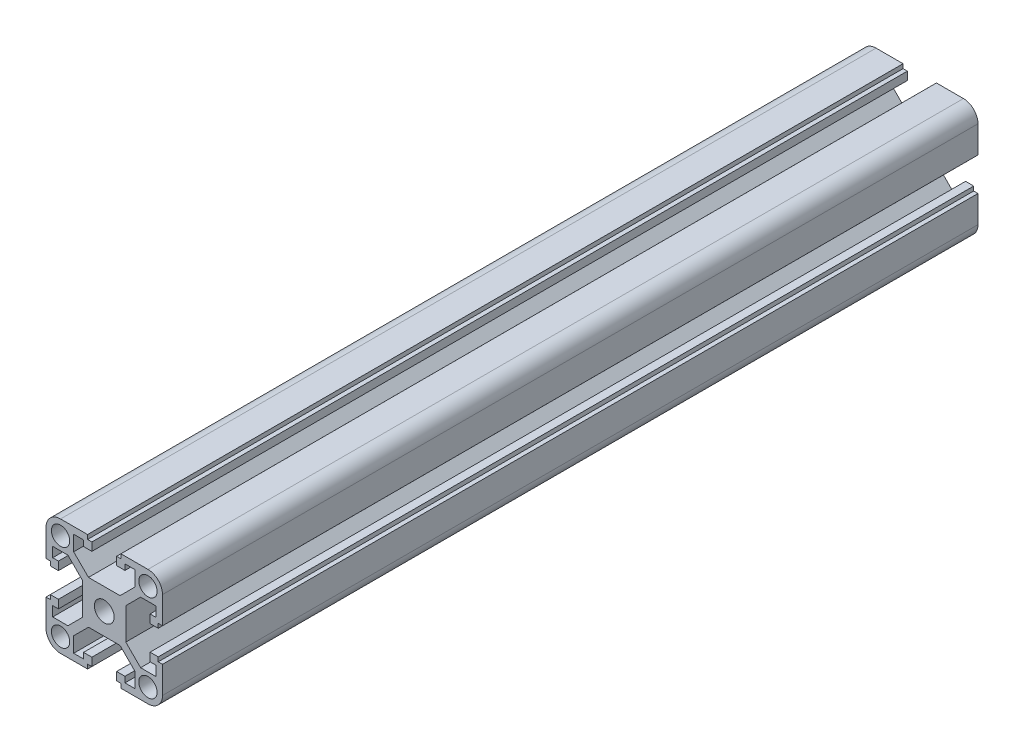
from build123d import *

# Parameters (mm, degrees)
SKETCH_1_R      = 3.4
SKETCH_1_R_2    = 3.15
EXTRUDE_1_DEPTH = 140


with BuildPart() as part:
    # Эскиз1 → Бобышка-Вытянуть1 (new, symmetric)
    with BuildSketch(Plane.XY):
        with BuildLine():
            Line((-15, 20), (-5.727351849, 20))
            Line((-5.727351849, 20), (-5.727351849, 18.530416438))
            Line((-5.727351849, 18.530416438), (-4.25, 18.530416438))
            Line((-4.25, 18.530416438), (-4.25, 15.732027397))
            Line((-4.25, 15.732027397), (-7.111831817, 15.732027397))
            Line((-7.111831817, 15.732027397), (-7.111831817, 17.7))
            Line((-7.111831817, 17.7), (-10.5, 17.7))
            Line((-10.5, 17.7), (-10.5, 12.479898987))
            Line((-10.5, 12.479898987), (-5.420101013, 7.4))
            Line((-5.420101013, 7.4), (5.420101013, 7.4))
            Line((5.420101013, 7.4), (10.5, 12.479898987))
            Line((10.5, 12.479898987), (10.5, 17.7))
            Line((10.5, 17.7), (7.111831817, 17.7))
            Line((7.111831817, 17.7), (7.111831817, 15.732027397))
            Line((7.111831817, 15.732027397), (4.25, 15.732027397))
            Line((4.25, 15.732027397), (4.25, 18.530416438))
            Line((4.25, 18.530416438), (5.727351849, 18.530416438))
            Line((5.727351849, 18.530416438), (5.727351849, 20))
            Line((5.727351849, 20), (15, 20))
            ThreePointArc((15, 20), (18.535533906, 18.535533906), (20, 15))
            Line((20, 15), (20, 5.727351849))
            Line((20, 5.727351849), (18.530416438, 5.727351849))
            Line((18.530416438, 5.727351849), (18.530416438, 4.25))
            Line((18.530416438, 4.25), (15.732027397, 4.25))
            Line((15.732027397, 4.25), (15.732027397, 7.111831817))
            Line((15.732027397, 7.111831817), (17.7, 7.111831817))
            Line((17.7, 7.111831817), (17.7, 10.5))
            Line((17.7, 10.5), (12.479898987, 10.5))
            Line((12.479898987, 10.5), (7.4, 5.420101013))
            Line((7.4, 5.420101013), (7.4, -5.420101013))
            Line((7.4, -5.420101013), (12.479898987, -10.5))
            Line((12.479898987, -10.5), (17.7, -10.5))
            Line((17.7, -10.5), (17.7, -7.111831817))
            Line((17.7, -7.111831817), (15.732027397, -7.111831817))
            Line((15.732027397, -7.111831817), (15.732027397, -4.25))
            Line((15.732027397, -4.25), (18.530416438, -4.25))
            Line((18.530416438, -4.25), (18.530416438, -5.727351849))
            Line((18.530416438, -5.727351849), (20, -5.727351849))
            Line((20, -5.727351849), (20, -15))
            ThreePointArc((20, -15), (18.535533906, -18.535533906), (15, -20))
            Line((15, -20), (5.727351849, -20))
            Line((5.727351849, -20), (5.727351849, -18.530416438))
            Line((5.727351849, -18.530416438), (4.25, -18.530416438))
            Line((4.25, -18.530416438), (4.25, -15.732027397))
            Line((4.25, -15.732027397), (7.111831817, -15.732027397))
            Line((7.111831817, -15.732027397), (7.111831817, -17.7))
            Line((7.111831817, -17.7), (10.5, -17.7))
            Line((10.5, -17.7), (10.5, -12.479898987))
            Line((10.5, -12.479898987), (5.420101013, -7.4))
            Line((5.420101013, -7.4), (-5.420101013, -7.4))
            Line((-5.420101013, -7.4), (-10.5, -12.479898987))
            Line((-10.5, -12.479898987), (-10.5, -17.7))
            Line((-10.5, -17.7), (-7.111831817, -17.7))
            Line((-7.111831817, -17.7), (-7.111831817, -15.732027397))
            Line((-7.111831817, -15.732027397), (-4.25, -15.732027397))
            Line((-4.25, -15.732027397), (-4.25, -18.530416438))
            Line((-4.25, -18.530416438), (-5.727351849, -18.530416438))
            Line((-5.727351849, -18.530416438), (-5.727351849, -20))
            Line((-5.727351849, -20), (-15, -20))
            ThreePointArc((-15, -20), (-18.535533906, -18.535533906), (-20, -15))
            Line((-20, -15), (-20, -5.727351849))
            Line((-20, -5.727351849), (-18.530416438, -5.727351849))
            Line((-18.530416438, -5.727351849), (-18.530416438, -4.25))
            Line((-18.530416438, -4.25), (-15.732027397, -4.25))
            Line((-15.732027397, -4.25), (-15.732027397, -7.111831817))
            Line((-15.732027397, -7.111831817), (-17.7, -7.111831817))
            Line((-17.7, -7.111831817), (-17.7, -10.5))
            Line((-17.7, -10.5), (-12.479898987, -10.5))
            Line((-12.479898987, -10.5), (-7.4, -5.420101013))
            Line((-7.4, -5.420101013), (-7.4, 5.420101013))
            Line((-7.4, 5.420101013), (-12.479898987, 10.5))
            Line((-12.479898987, 10.5), (-17.7, 10.5))
            Line((-17.7, 10.5), (-17.7, 7.111831817))
            Line((-17.7, 7.111831817), (-15.732027397, 7.111831817))
            Line((-15.732027397, 7.111831817), (-15.732027397, 4.25))
            Line((-15.732027397, 4.25), (-18.530416438, 4.25))
            Line((-18.530416438, 4.25), (-18.530416438, 5.727351849))
            Line((-18.530416438, 5.727351849), (-20, 5.727351849))
            Line((-20, 5.727351849), (-20, 15))
            ThreePointArc((-20, 15), (-18.535533906, 18.535533906), (-15, 20))
        make_face()
        Circle(SKETCH_1_R, mode=Mode.SUBTRACT)
        with Locations((-15, 15)):
            Circle(SKETCH_1_R_2, mode=Mode.SUBTRACT)
        with Locations((15, 15)):
            Circle(SKETCH_1_R_2, mode=Mode.SUBTRACT)
        with Locations((15, -15)):
            Circle(SKETCH_1_R_2, mode=Mode.SUBTRACT)
        with Locations((-15, -15)):
            Circle(SKETCH_1_R_2, mode=Mode.SUBTRACT)
    extrude(amount=EXTRUDE_1_DEPTH, both=True)


solid = part.part
